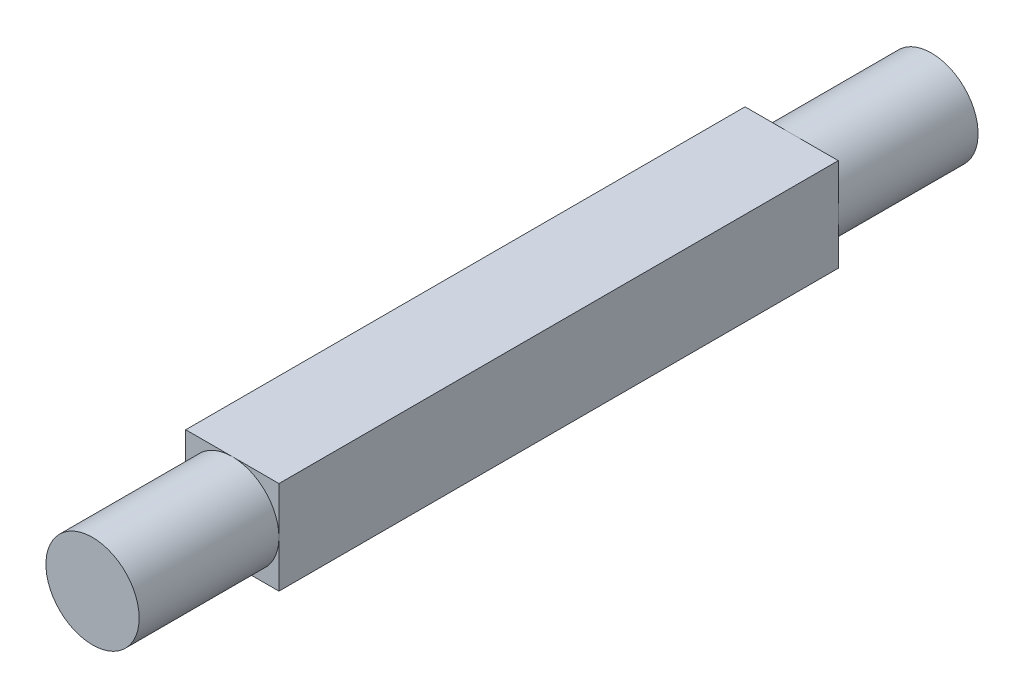
from build123d import *

# Parameters (mm, degrees)
SKETCH_1_W      = 2
SKETCH_1_H      = 2
EXTRUDE_1_DEPTH = 12
SKETCH_2_R      = 1
EXTRUDE_2_DEPTH = 3
EXTRUDE_START   = 3
SKETCH_3_R      = 1
EXTRUDE_3_DEPTH = 3


with BuildPart() as part:
    # Эскиз1 → Бобышка-Вытянуть1 (new body)
    with BuildSketch(Plane.XY):
        Rectangle(SKETCH_1_W, SKETCH_1_H)
    extrude(amount=EXTRUDE_1_DEPTH)

    # Эскиз2 → Бобышка-Вытянуть2 (add)
    with BuildSketch(Plane.XY.offset(12)):
        Circle(SKETCH_2_R)
    extrude(amount=EXTRUDE_2_DEPTH)

    # Эскиз3 → Бобышка-Вытянуть3 (add)
    with BuildSketch(Plane(origin=(0, 0, 0), x_dir=(-1, 0, 0), z_dir=(0, 0, -1)).offset(EXTRUDE_START)):
        with Locations(Location((0, 0, 0), (0, 0, 180))):
            Circle(SKETCH_3_R)
    extrude(amount=-EXTRUDE_3_DEPTH)


solid = part.part
